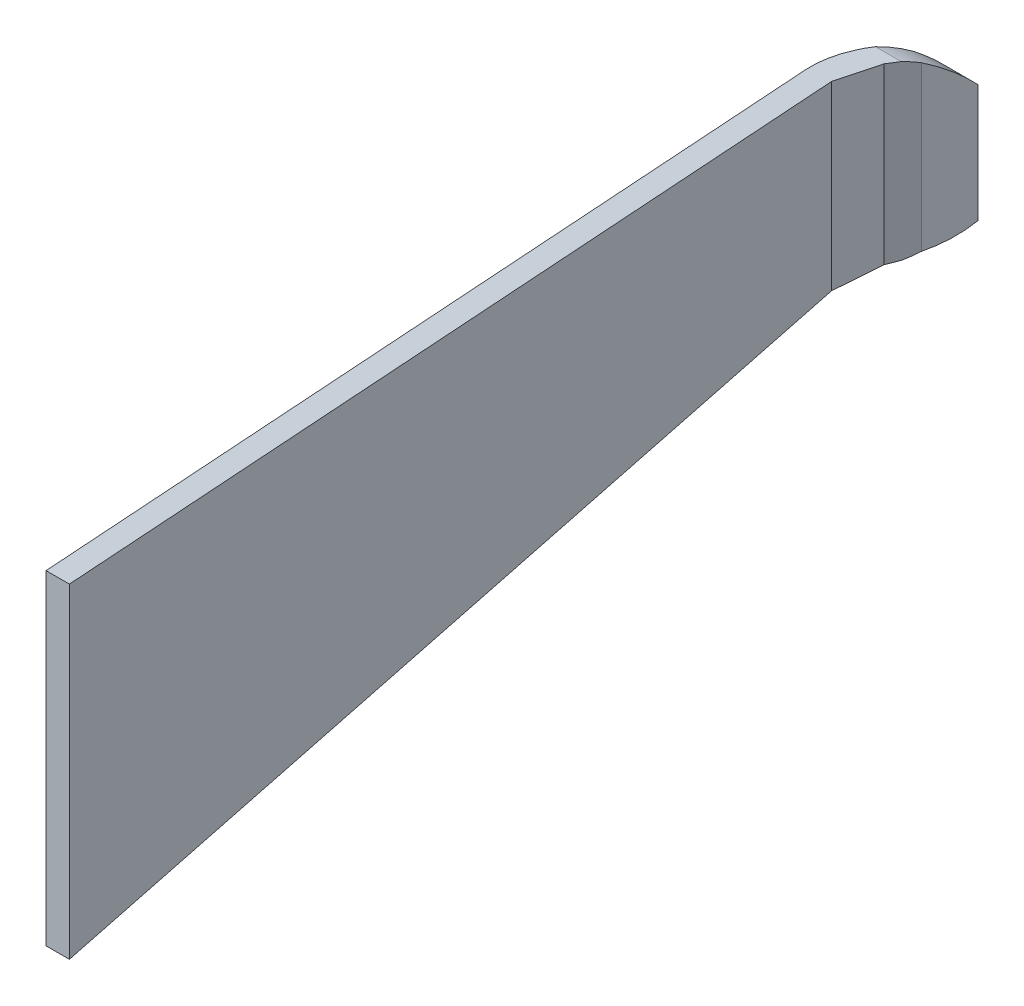
from build123d import *

# Parameters (mm, degrees)
BOSS_EXTRUDE1_DEPTH = 3
SKETCH5_W           = 0.151526287
SKETCH5_H           = 0.001
BOSS_EXTRUDE2_DEPTH = 3
CUT_EXTRUDE1_DEPTH  = 10


with BuildPart() as part:
    # Sketch2 → Boss-Extrude1 (new body)
    with BuildSketch(Plane(origin=(0, 0, 0), x_dir=(1, 0, 0), z_dir=(0, 1, 0))):
        with BuildLine():
            Line((7.350781328, -4.074037176), (6.525926163, 1.693470822))
            Line((6.525926163, 1.693470822), (6.572920215, 1.986347748))
            Line((6.572920215, 1.986347748), (6.653421311, 2.148724708))
            Line((6.653421311, 2.148724708), (6.812248323, 2.356937113))
            Line((6.812248323, 2.356937113), (6.692985769, 2.447912072))
            Line((6.692985769, 2.447912072), (6.525425984, 2.228251541))
            Line((6.525425984, 2.228251541), (6.438529344, 2.052974273))
            ThreePointArc((6.438529344, 2.052974273), (6.379099159, 1.867238909), (6.377437076, 1.672234269))
            Line((6.377437076, 1.672234269), (7.199255041, -4.074037176))
            Line((7.199255041, -4.074037176), (7.200781328, -4.074037176))
            Line((7.200781328, -4.074037176), (7.350781328, -4.074037176))
        make_face()
    extrude(amount=BOSS_EXTRUDE1_DEPTH)

    # Sketch5 → Boss-Extrude2 (add)
    with BuildSketch(Plane(origin=(0, 3, 0), x_dir=(1, 0, 0), z_dir=(0, 1, 0))):
        with Locations((7.275018185, -4.074537176)):
            Rectangle(SKETCH5_W, SKETCH5_H)
    extrude(amount=-BOSS_EXTRUDE2_DEPTH)

    # Sketch6 → Cut-Extrude1 (cut)
    with BuildSketch(Plane(origin=(7.350781328, 0, 0), x_dir=(0, 0, -1), z_dir=(1, 0, 0))):
        with BuildLine():
            Line((-4.338213524, 2.884617609), (-4.338213524, 3.4381611))
            Line((-4.338213524, 3.4381611), (3.164112777, 3.4381611))
            Line((3.164112777, 3.4381611), (3.164112777, -0.438544946))
            Line((3.164112777, -0.438544946), (-4.348844922, -0.438544946))
            Line((-4.348844922, -0.438544946), (-4.337569204, 0.13248559))
            ThreePointArc((-4.337569204, 0.13248559), (-4.436691825, 0.166168098), (-4.478844922, 0.26199566))
            Line((-4.478844922, 0.26199566), (-4.478844922, 0.302134153))
            ThreePointArc((-4.478844922, 0.302134153), (-4.44607086, 0.391599096), (-4.359634831, 0.431685602))
            Line((-4.359634831, 0.431685602), (2.061660338, 0.9419327))
            ThreePointArc((2.061660338, 0.9419327), (2.502438753, 1.500467574), (2.061048418, 2.058518994))
            Line((2.061048418, 2.058518994), (-3.928609238, 2.549999344))
            Line((-3.928609238, 2.549999344), (-4.178844922, 2.570532391))
            Line((-4.178844922, 2.570532391), (-4.35947632, 2.585354069))
            ThreePointArc((-4.35947632, 2.585354069), (-4.444453713, 2.626833668), (-4.478844922, 2.714918622))
            Line((-4.478844922, 2.714918622), (-4.478844922, 2.755053056))
            ThreePointArc((-4.478844922, 2.755053056), (-4.436929876, 2.850661847), (-4.338213524, 2.884617609))
        make_face()
    extrude(amount=-CUT_EXTRUDE1_DEPTH, mode=Mode.SUBTRACT)


solid = part.part
